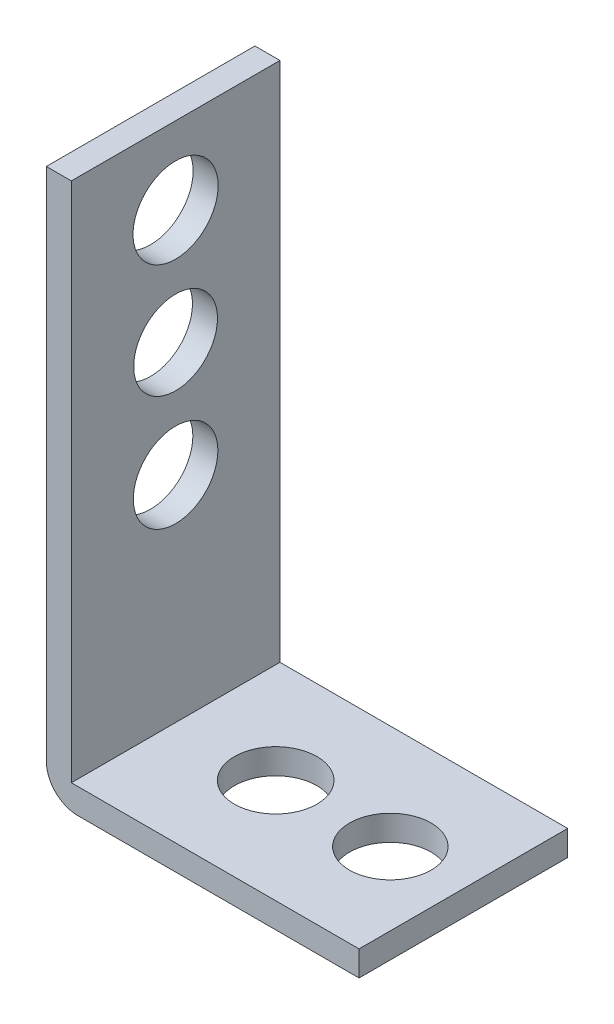
from build123d import *

# Parameters (mm, degrees)
SKETCH1_W           = 38.1
SKETCH1_H           = 25.415165138
BOSS_EXTRUDE1_DEPTH = 3.0734
SKETCH2_W           = 28.174522189
SKETCH2_H           = 63.5
BOSS_EXTRUDE2_DEPTH = 3.048
SKETCH3_W           = 2.759357051
SKETCH3_H           = 63.5
CUT_EXTRUDE1_DEPTH  = 3.048
FILLET1_R           = 3.81
SKETCH4_R           = 5.185736545
SKETCH4_R_2         = 5.105364429
SKETCH4_R_3         = 5.151648863
CUT_EXTRUDE2_DEPTH  = 3.048
SKETCH5_R           = 5.027262634
SKETCH5_R_2         = 4.974374785
CUT_EXTRUDE3_DEPTH  = 3.556


with BuildPart() as part:
    # Sketch1 → Boss-Extrude1 (new body)
    with BuildSketch(Plane(origin=(0, 0, 0), x_dir=(1, 0, 0), z_dir=(0, 1, 0))):
        with Locations((-19.05, 12.707582569)):
            Rectangle(SKETCH1_W, SKETCH1_H)
    extrude(amount=BOSS_EXTRUDE1_DEPTH)

    # Sketch2 → Boss-Extrude2 (add)
    with BuildSketch(Plane.ZY.offset(38.1)):
        with Locations((-11.327904044, 34.8234)):
            Rectangle(SKETCH2_W, SKETCH2_H)
    extrude(amount=-BOSS_EXTRUDE2_DEPTH)

    # Sketch3 → Cut-Extrude1 (cut)
    with BuildSketch(Plane(origin=(-35.052, 0, 0), x_dir=(0, 0, -1), z_dir=(1, 0, 0))):
        with Locations((-1.379678526, 34.8234)):
            Rectangle(SKETCH3_W, SKETCH3_H)
    extrude(amount=-CUT_EXTRUDE1_DEPTH, mode=Mode.SUBTRACT)

    # Fillet1
    fillet1_edges = [part.edges().sort_by_distance(p)[0] for p in [
        (-38.1, 0, -12.707582569),
    ]]
    fillet(fillet1_edges, radius=FILLET1_R)

    # Sketch4 → Cut-Extrude2 (cut)
    with BuildSketch(Plane(origin=(-35.052, 0, 0), x_dir=(0, 0, -1), z_dir=(1, 0, 0))):
        with Locations((12.7, 57.15)):
            Circle(SKETCH4_R)
        with Locations((12.7, 43.18)):
            Circle(SKETCH4_R_2)
        with Locations((12.7, 29.21)):
            Circle(SKETCH4_R_3)
    extrude(amount=-CUT_EXTRUDE2_DEPTH, mode=Mode.SUBTRACT)

    # Sketch5 → Cut-Extrude3 (cut)
    with BuildSketch(Plane(origin=(0, 0, 0), x_dir=(-1, 0, 0), z_dir=(0, -1, 0))):
        with Locations(Location((22.86, 12.7, 0), (0, 0, 90))):
            Circle(SKETCH5_R)
        with Locations(Location((8.89, 12.7, 0), (0, 0, 90))):
            Circle(SKETCH5_R_2)
    extrude(amount=-CUT_EXTRUDE3_DEPTH, mode=Mode.SUBTRACT)


solid = part.part
